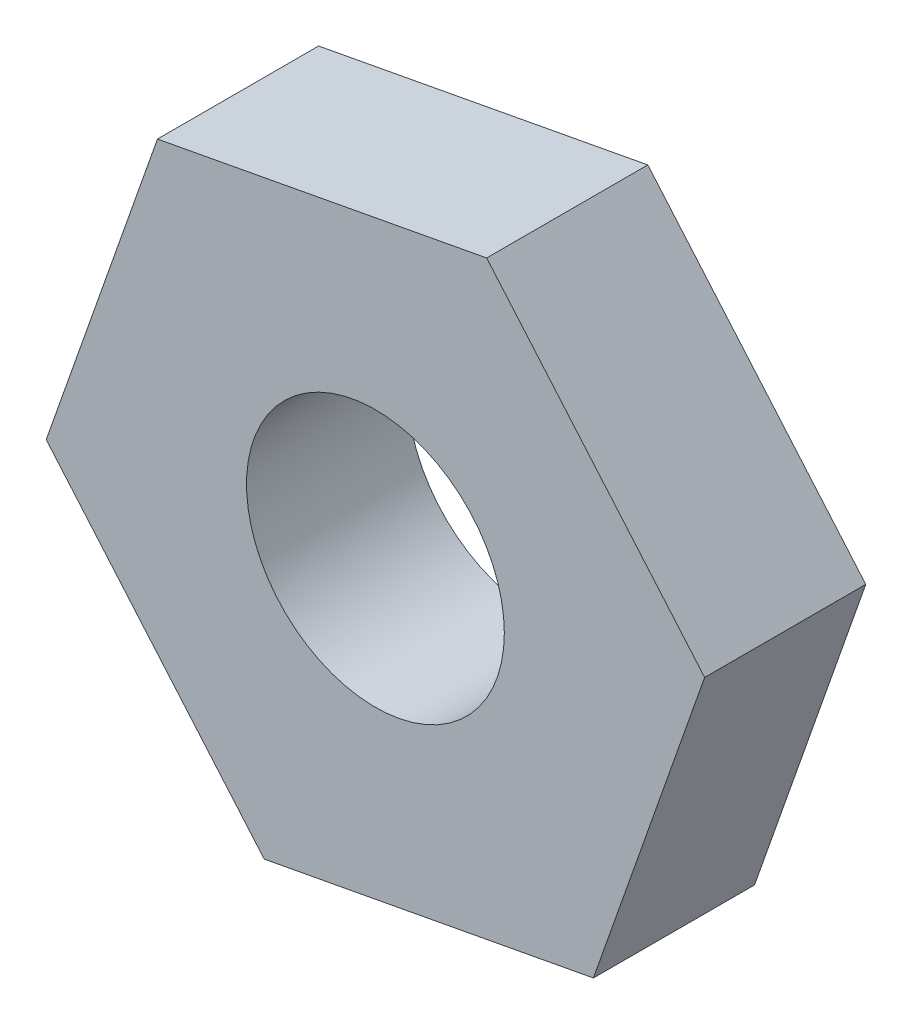
from build123d import *

# Parameters (mm, degrees)
SKETCH1_R           = 4
BOSS_EXTRUDE1_DEPTH = 2.5


with BuildPart() as part:
    # Sketch1 → Boss-Extrude1 (new, symmetric)
    with BuildSketch(Plane.XY):
        Polygon((6.763222344, -7.890426068), (10.214920593, 1.911909327), (3.451698249, 9.802335395), (-6.763222344, 7.890426068), (-10.214920593, -1.911909327), (-3.451698249, -9.802335395), align=None)
        Circle(SKETCH1_R, mode=Mode.SUBTRACT)
    extrude(amount=BOSS_EXTRUDE1_DEPTH, both=True)


solid = part.part
